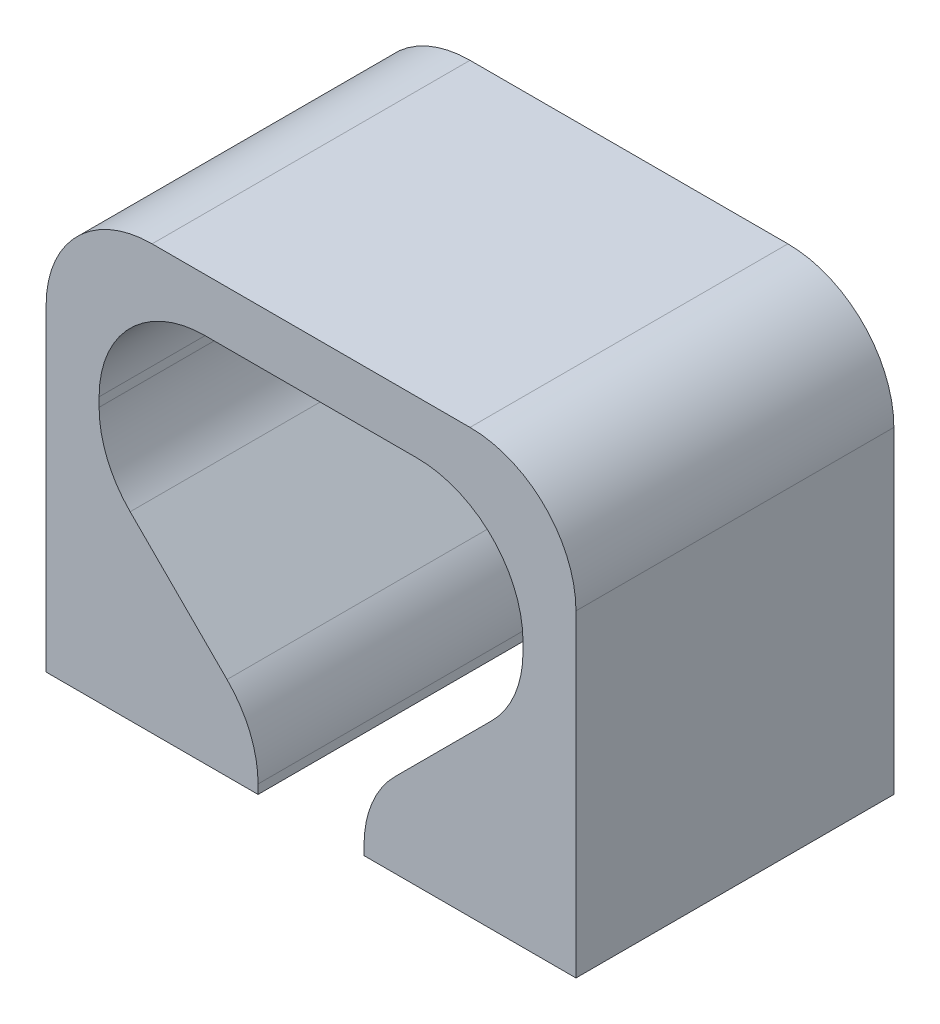
from build123d import *

# Parameters (mm, degrees)
BOSS_EXTRUDE1_DEPTH      = 7.5
BOSS_EXTRUDE1_DEPTH_BACK = 7.5
FILLET1_R                = 5


with BuildPart() as part:
    # Sketch1 → Boss-Extrude1 (new, two sides: drawn at the far end of the back side and taken through both)
    with BuildSketch(Plane.XY.offset(-BOSS_EXTRUDE1_DEPTH_BACK)):
        Polygon((-12.5, 20), (12.5, 20), (12.5, 0), (2.5, 0), (2.5, 2.5), (10, 10), (10, 17.5), (-10, 17.5), (-10, 10), (-2.5, 2.5), (-2.5, 0), (-12.5, 0), align=None)
    extrude(amount=BOSS_EXTRUDE1_DEPTH + BOSS_EXTRUDE1_DEPTH_BACK)

    # Fillet1
    fillet1_edges = [part.edges().sort_by_distance(p)[0] for p in [
        (12.5, 20, 0),
        (-12.5, 20, 0),
        (10, 17.5, 0),
        (-10, 17.5, 0),
        (10, 10, 0),
        (2.5, 2.5, 0),
        (-2.5, 2.5, 0),
        (-10, 10, 0),
    ]]
    fillet(fillet1_edges, radius=FILLET1_R)


solid = part.part
